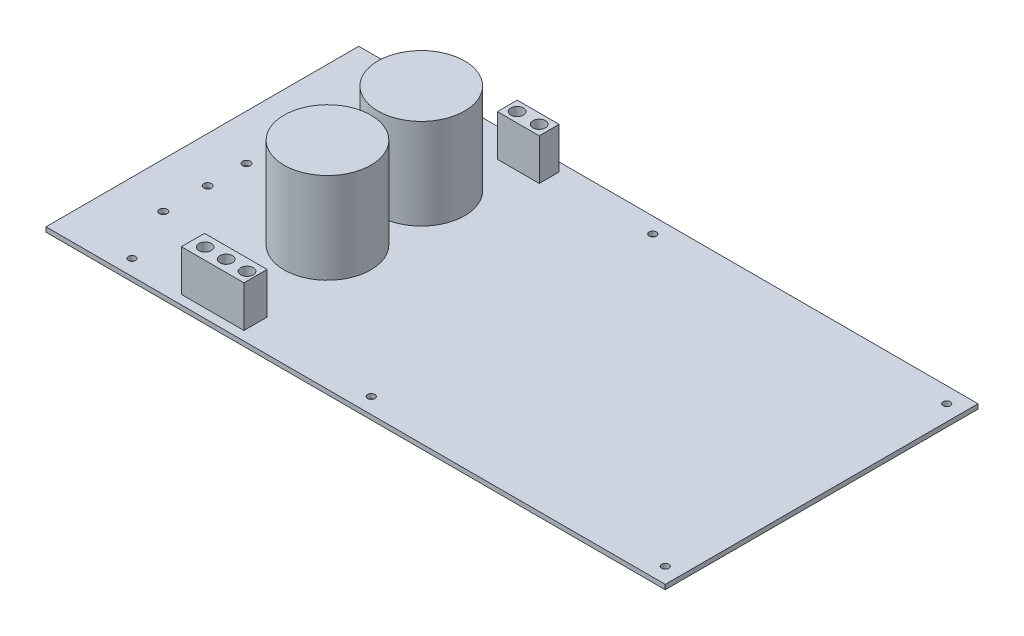
from build123d import *

# Parameters (mm, degrees)
SKETCH1_W      = 251.46
SKETCH1_H      = 127
SKETCH1_R      = 1.4605
SKETCH1_R_2    = 1.5875
EXTRUDE1_DEPTH = 1.905
SKETCH2_R      = 17.62125
EXTRUDE2_DEPTH = 36.83
SKETCH3_W      = 25.4
SKETCH3_H      = 9.398
SKETCH3_R      = 2.54
SKETCH3_W_2    = 17.018
SKETCH3_H_2    = 8.0717042
EXTRUDE3_DEPTH = 16.764


with BuildPart() as part:
    # Sketch1 → Extrude1 (new body)
    with BuildSketch(Plane(origin=(0, 0, 0), x_dir=(1, 0, 0), z_dir=(0, 1, 0))):
        with Locations((125.73, -63.5)):
            Rectangle(SKETCH1_W, SKETCH1_H)
        with Locations(Location((28.575, -120.65, 0), (0, 0, 270))):
            Circle(SKETCH1_R, mode=Mode.SUBTRACT)
        with Locations(Location((28.575, -6.35, 0), (0, 0, 270))):
            Circle(SKETCH1_R, mode=Mode.SUBTRACT)
        with Locations(Location((245.11, -6.35, 0), (0, 0, 270))):
            Circle(SKETCH1_R, mode=Mode.SUBTRACT)
        with Locations(Location((245.11, -120.65, 0), (0, 0, 270))):
            Circle(SKETCH1_R, mode=Mode.SUBTRACT)
        with Locations(Location((125.73, -6.35, 0), (0, 0, 270))):
            Circle(SKETCH1_R, mode=Mode.SUBTRACT)
        with Locations(Location((125.73, -120.65, 0), (0, 0, 270))):
            Circle(SKETCH1_R, mode=Mode.SUBTRACT)
        with Locations(Location((18.415, -44.45, 0), (0, 0, 270))):
            Circle(SKETCH1_R_2, mode=Mode.SUBTRACT)
        with Locations(Location((18.415, -79.755956549, 0), (0, 0, 270))):
            Circle(SKETCH1_R_2, mode=Mode.SUBTRACT)
        with Locations(Location((18.415, -64.034066138, 0), (0, 0, 270))):
            Circle(SKETCH1_R_2, mode=Mode.SUBTRACT)
        with Locations(Location((18.415, -97.79, 0), (0, 0, 270))):
            Circle(SKETCH1_R_2, mode=Mode.SUBTRACT)
    extrude(amount=-EXTRUDE1_DEPTH)

    # Sketch2 → Extrude2 (add)
    with BuildSketch(Plane(origin=(0, 0, 0), x_dir=(1, 0, 0), z_dir=(0, 1, 0))):
        with Locations(Location((63.5, -76.2, 0), (0, 0, 270))):
            Circle(SKETCH2_R)
        with Locations(Location((63.5, -38.1, 0), (0, 0, 270))):
            Circle(SKETCH2_R)
    extrude(amount=EXTRUDE2_DEPTH)

    # Sketch3 → Extrude3 (add)
    # profile 1 of 2: a face of its own
    with BuildSketch(Plane(origin=(0, 0, 0), x_dir=(1, 0, 0), z_dir=(0, 1, 0))):
        with Locations((63.950056038, -118.57149124)):
            Rectangle(SKETCH3_W, SKETCH3_H)
        with Locations(Location((56.195547634, -118.584869875, 0), (0, 0, 270))):
            Circle(SKETCH3_R, mode=Mode.SUBTRACT)
        with Locations(Location((64.741474732, -118.584869875, 0), (0, 0, 270))):
            Circle(SKETCH3_R, mode=Mode.SUBTRACT)
        with Locations(Location((73.219619493, -118.584869875, 0), (0, 0, 270))):
            Circle(SKETCH3_R, mode=Mode.SUBTRACT)
    # profile 2 of 2: a face of its own
    with BuildSketch(Plane(origin=(0, 0, 0), x_dir=(1, 0, 0), z_dir=(0, 1, 0))):
        with Locations((76.396506794, -7.572762817)):
            Rectangle(SKETCH3_W_2, SKETCH3_H_2)
        with Locations(Location((71.865279643, -7.572762817, 0), (0, 0, 270))):
            Circle(SKETCH3_R, mode=Mode.SUBTRACT)
        with Locations(Location((80.836132406, -7.572762817, 0), (0, 0, 270))):
            Circle(SKETCH3_R, mode=Mode.SUBTRACT)
    extrude(amount=EXTRUDE3_DEPTH)


solid = part.part
